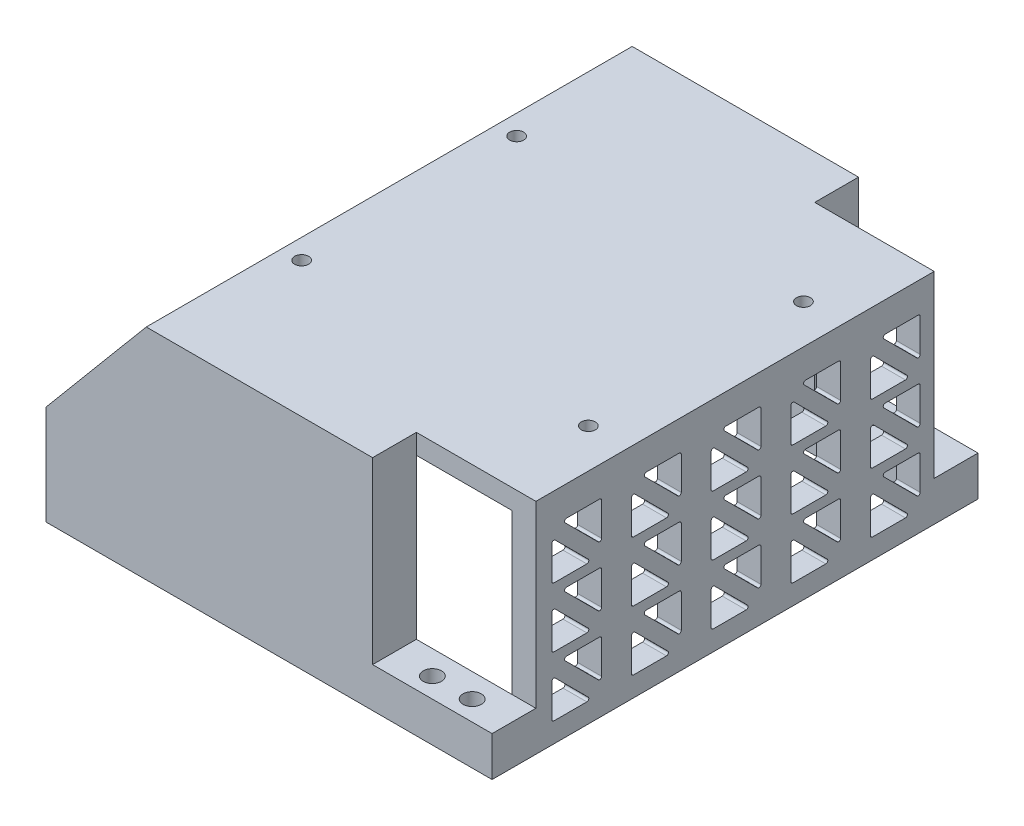
from build123d import *

# Parameters (mm, degrees)
BOSS_EXTRUDE1_DEPTH   = 50
SKETCH1_W             = 6
SKETCH1_H             = 100
BOSS_EXTRUDE1_2_DEPTH = 50
SKETCH1_3_R           = 2.3
BOSS_EXTRUDE2_DEPTH   = 10
CUT_EXTRUDE1_DEPTH    = 6
BOSS_EXTRUDE3_DEPTH   = 5
CHAMFER1_SIZE         = 30
CHAMFER1_SIZE2        = 25.172988935
CUT_EXTRUDE2_REACH    = 176.508
SKETCH4_R             = 1.75
CUT_EXTRUDE3_START    = -11
CUT_EXTRUDE3_DEPTH    = 100


with BuildPart() as part:
    # Sketch1 → Boss-Extrude1 (new body)
    with BuildSketch(Plane(origin=(0, 0, 0), x_dir=(1, 0, 0), z_dir=(0, 1, 0))):
        Polygon((0, 122), (0, 0), (82, 0), (82, 11), (26, 11), (26, 111), (82, 111), (82, 122), align=None)
    extrude(amount=BOSS_EXTRUDE1_DEPTH)



with BuildPart() as body_2:
    # Sketch1 → Boss-Extrude1 2 (new body)
    with BuildSketch(Plane(origin=(0, 0, 0), x_dir=(1, 0, 0), z_dir=(0, 1, 0))):
        with Locations((109, 61)):
            Rectangle(SKETCH1_W, SKETCH1_H)
    extrude(amount=BOSS_EXTRUDE1_2_DEPTH)


with BuildPart() as part_1:
    add(part.part)

    add(body_2.part)  # Boss-Extrude2 merges body 2
    # Sketch1<3> → Boss-Extrude2 (add)
    # profile 1 of 2: a face of its own
    with BuildSketch(Plane(origin=(0, 0, 0), x_dir=(1, 0, 0), z_dir=(0, 1, 0))):
        Polygon((112, 122), (82, 122), (82, 111), (106, 111), (112, 111), align=None)
        with Locations(Location((92, 117, 0), (0, 0, 270))):
            Circle(SKETCH1_3_R, mode=Mode.SUBTRACT)
        with Locations(Location((102, 117, 0), (0, 0, 270))):
            Circle(SKETCH1_3_R, mode=Mode.SUBTRACT)
    # profile 2 of 2: a face of its own
    with BuildSketch(Plane(origin=(0, 0, 0), x_dir=(1, 0, 0), z_dir=(0, 1, 0))):
        Polygon((82, 11), (82, 0), (112, 0), (112, 11), (106, 11), align=None)
        with Locations(Location((92, 5, 0), (0, 0, 270))):
            Circle(SKETCH1_3_R, mode=Mode.SUBTRACT)
        with Locations(Location((102, 5, 0), (0, 0, 270))):
            Circle(SKETCH1_3_R, mode=Mode.SUBTRACT)
    extrude(amount=BOSS_EXTRUDE2_DEPTH)

    # Sketch2 → Cut-Extrude1 (cut)
    with BuildSketch(Plane(origin=(112, 0, 0), x_dir=(0, 0, -1), z_dir=(1, 0, 0))):
        with BuildLine():
            Line((15, 35.5), (15, 43.792893219))
            ThreePointArc((15, 43.792893219), (15.308658284, 44.254832985), (15.853553391, 44.146446609))
            Line((15.853553391, 44.146446609), (24.146446609, 35.853553391))
            ThreePointArc((24.146446609, 35.853553391), (24.254832985, 35.308658284), (23.792893219, 35))
            Line((23.792893219, 35), (15.5, 35))
            ThreePointArc((15.5, 35), (15.146446609, 35.146446609), (15, 35.5))
        make_face()
        with BuildLine():
            Line((27.5, 38.707106781), (27.5, 47))
            ThreePointArc((27.5, 47), (27.353553391, 47.353553391), (27, 47.5))
            Line((27, 47.5), (18.707106781, 47.5))
            ThreePointArc((18.707106781, 47.5), (18.245167015, 47.191341716), (18.353553391, 46.646446609))
            Line((18.353553391, 46.646446609), (26.646446609, 38.353553391))
            ThreePointArc((26.646446609, 38.353553391), (27.191341716, 38.245167015), (27.5, 38.707106781))
        make_face()
        with BuildLine():
            Line((43.792893219, 35), (35.5, 35))
            ThreePointArc((35.5, 35), (35.146446609, 35.146446609), (35, 35.5))
            Line((35, 35.5), (35, 43.792893219))
            ThreePointArc((35, 43.792893219), (35.308658284, 44.254832985), (35.853553391, 44.146446609))
            Line((35.853553391, 44.146446609), (44.146446609, 35.853553391))
            ThreePointArc((44.146446609, 35.853553391), (44.254832985, 35.308658284), (43.792893219, 35))
        make_face()
        with BuildLine():
            Line((38.353553391, 46.646446609), (46.646446609, 38.353553391))
            ThreePointArc((46.646446609, 38.353553391), (47.191341716, 38.245167015), (47.5, 38.707106781))
            Line((47.5, 38.707106781), (47.5, 47))
            ThreePointArc((47.5, 47), (47.353553391, 47.353553391), (47, 47.5))
            Line((47, 47.5), (38.707106781, 47.5))
            ThreePointArc((38.707106781, 47.5), (38.245167015, 47.191341716), (38.353553391, 46.646446609))
        make_face()
        with BuildLine():
            Line((63.792893219, 35), (55.5, 35))
            ThreePointArc((55.5, 35), (55.146446609, 35.146446609), (55, 35.5))
            Line((55, 35.5), (55, 43.792893219))
            ThreePointArc((55, 43.792893219), (55.308658284, 44.254832985), (55.853553391, 44.146446609))
            Line((55.853553391, 44.146446609), (64.146446609, 35.853553391))
            ThreePointArc((64.146446609, 35.853553391), (64.254832985, 35.308658284), (63.792893219, 35))
        make_face()
        with BuildLine():
            Line((58.353553391, 46.646446609), (66.646446609, 38.353553391))
            ThreePointArc((66.646446609, 38.353553391), (67.191341716, 38.245167015), (67.5, 38.707106781))
            Line((67.5, 38.707106781), (67.5, 47))
            ThreePointArc((67.5, 47), (67.353553391, 47.353553391), (67, 47.5))
            Line((67, 47.5), (58.707106781, 47.5))
            ThreePointArc((58.707106781, 47.5), (58.245167015, 47.191341716), (58.353553391, 46.646446609))
        make_face()
        with BuildLine():
            Line((83.792893219, 35), (75.5, 35))
            ThreePointArc((75.5, 35), (75.146446609, 35.146446609), (75, 35.5))
            Line((75, 35.5), (75, 43.792893219))
            ThreePointArc((75, 43.792893219), (75.308658284, 44.254832985), (75.853553391, 44.146446609))
            Line((75.853553391, 44.146446609), (84.146446609, 35.853553391))
            ThreePointArc((84.146446609, 35.853553391), (84.254832985, 35.308658284), (83.792893219, 35))
        make_face()
        with BuildLine():
            Line((78.353553391, 46.646446609), (86.646446609, 38.353553391))
            ThreePointArc((86.646446609, 38.353553391), (87.191341716, 38.245167015), (87.5, 38.707106781))
            Line((87.5, 38.707106781), (87.5, 47))
            ThreePointArc((87.5, 47), (87.353553391, 47.353553391), (87, 47.5))
            Line((87, 47.5), (78.707106781, 47.5))
            ThreePointArc((78.707106781, 47.5), (78.245167015, 47.191341716), (78.353553391, 46.646446609))
        make_face()
        with BuildLine():
            Line((103.792893219, 35), (95.5, 35))
            ThreePointArc((95.5, 35), (95.146446609, 35.146446609), (95, 35.5))
            Line((95, 35.5), (95, 43.792893219))
            ThreePointArc((95, 43.792893219), (95.308658284, 44.254832985), (95.853553391, 44.146446609))
            Line((95.853553391, 44.146446609), (104.146446609, 35.853553391))
            ThreePointArc((104.146446609, 35.853553391), (104.254832985, 35.308658284), (103.792893219, 35))
        make_face()
        with BuildLine():
            Line((98.353553391, 46.646446609), (106.646446609, 38.353553391))
            ThreePointArc((106.646446609, 38.353553391), (107.191341716, 38.245167015), (107.5, 38.707106781))
            Line((107.5, 38.707106781), (107.5, 47))
            ThreePointArc((107.5, 47), (107.353553391, 47.353553391), (107, 47.5))
            Line((107, 47.5), (98.707106781, 47.5))
            ThreePointArc((98.707106781, 47.5), (98.245167015, 47.191341716), (98.353553391, 46.646446609))
        make_face()
        with BuildLine():
            Line((43.792893219, 20), (35.5, 20))
            ThreePointArc((35.5, 20), (35.146446609, 20.146446609), (35, 20.5))
            Line((35, 20.5), (35, 28.792893219))
            ThreePointArc((35, 28.792893219), (35.308658284, 29.254832985), (35.853553391, 29.146446609))
            Line((35.853553391, 29.146446609), (44.146446609, 20.853553391))
            ThreePointArc((44.146446609, 20.853553391), (44.254832985, 20.308658284), (43.792893219, 20))
        make_face()
        with BuildLine():
            Line((38.353553391, 31.646446609), (46.646446609, 23.353553391))
            ThreePointArc((46.646446609, 23.353553391), (47.191341716, 23.245167015), (47.5, 23.707106781))
            Line((47.5, 23.707106781), (47.5, 32))
            ThreePointArc((47.5, 32), (47.353553391, 32.353553391), (47, 32.5))
            Line((47, 32.5), (38.707106781, 32.5))
            ThreePointArc((38.707106781, 32.5), (38.245167015, 32.191341716), (38.353553391, 31.646446609))
        make_face()
        with BuildLine():
            Line((63.792893219, 20), (55.5, 20))
            ThreePointArc((55.5, 20), (55.146446609, 20.146446609), (55, 20.5))
            Line((55, 20.5), (55, 28.792893219))
            ThreePointArc((55, 28.792893219), (55.308658284, 29.254832985), (55.853553391, 29.146446609))
            Line((55.853553391, 29.146446609), (64.146446609, 20.853553391))
            ThreePointArc((64.146446609, 20.853553391), (64.254832985, 20.308658284), (63.792893219, 20))
        make_face()
        with BuildLine():
            Line((58.353553391, 31.646446609), (66.646446609, 23.353553391))
            ThreePointArc((66.646446609, 23.353553391), (67.191341716, 23.245167015), (67.5, 23.707106781))
            Line((67.5, 23.707106781), (67.5, 32))
            ThreePointArc((67.5, 32), (67.353553391, 32.353553391), (67, 32.5))
            Line((67, 32.5), (58.707106781, 32.5))
            ThreePointArc((58.707106781, 32.5), (58.245167015, 32.191341716), (58.353553391, 31.646446609))
        make_face()
        with BuildLine():
            Line((83.792893219, 20), (75.5, 20))
            ThreePointArc((75.5, 20), (75.146446609, 20.146446609), (75, 20.5))
            Line((75, 20.5), (75, 28.792893219))
            ThreePointArc((75, 28.792893219), (75.308658284, 29.254832985), (75.853553391, 29.146446609))
            Line((75.853553391, 29.146446609), (84.146446609, 20.853553391))
            ThreePointArc((84.146446609, 20.853553391), (84.254832985, 20.308658284), (83.792893219, 20))
        make_face()
        with BuildLine():
            Line((78.353553391, 31.646446609), (86.646446609, 23.353553391))
            ThreePointArc((86.646446609, 23.353553391), (87.191341716, 23.245167015), (87.5, 23.707106781))
            Line((87.5, 23.707106781), (87.5, 32))
            ThreePointArc((87.5, 32), (87.353553391, 32.353553391), (87, 32.5))
            Line((87, 32.5), (78.707106781, 32.5))
            ThreePointArc((78.707106781, 32.5), (78.245167015, 32.191341716), (78.353553391, 31.646446609))
        make_face()
        with BuildLine():
            Line((103.792893219, 20), (95.5, 20))
            ThreePointArc((95.5, 20), (95.146446609, 20.146446609), (95, 20.5))
            Line((95, 20.5), (95, 28.792893219))
            ThreePointArc((95, 28.792893219), (95.308658284, 29.254832985), (95.853553391, 29.146446609))
            Line((95.853553391, 29.146446609), (104.146446609, 20.853553391))
            ThreePointArc((104.146446609, 20.853553391), (104.254832985, 20.308658284), (103.792893219, 20))
        make_face()
        with BuildLine():
            Line((98.353553391, 31.646446609), (106.646446609, 23.353553391))
            ThreePointArc((106.646446609, 23.353553391), (107.191341716, 23.245167015), (107.5, 23.707106781))
            Line((107.5, 23.707106781), (107.5, 32))
            ThreePointArc((107.5, 32), (107.353553391, 32.353553391), (107, 32.5))
            Line((107, 32.5), (98.707106781, 32.5))
            ThreePointArc((98.707106781, 32.5), (98.245167015, 32.191341716), (98.353553391, 31.646446609))
        make_face()
        with BuildLine():
            Line((43.792893219, 5), (35.5, 5))
            ThreePointArc((35.5, 5), (35.146446609, 5.146446609), (35, 5.5))
            Line((35, 5.5), (35, 13.792893219))
            ThreePointArc((35, 13.792893219), (35.308658284, 14.254832985), (35.853553391, 14.146446609))
            Line((35.853553391, 14.146446609), (44.146446609, 5.853553391))
            ThreePointArc((44.146446609, 5.853553391), (44.254832985, 5.308658284), (43.792893219, 5))
        make_face()
        with BuildLine():
            Line((38.353553391, 16.646446609), (46.646446609, 8.353553391))
            ThreePointArc((46.646446609, 8.353553391), (47.191341716, 8.245167015), (47.5, 8.707106781))
            Line((47.5, 8.707106781), (47.5, 17))
            ThreePointArc((47.5, 17), (47.353553391, 17.353553391), (47, 17.5))
            Line((47, 17.5), (38.707106781, 17.5))
            ThreePointArc((38.707106781, 17.5), (38.245167015, 17.191341716), (38.353553391, 16.646446609))
        make_face()
        with BuildLine():
            Line((63.792893219, 5), (55.5, 5))
            ThreePointArc((55.5, 5), (55.146446609, 5.146446609), (55, 5.5))
            Line((55, 5.5), (55, 13.792893219))
            ThreePointArc((55, 13.792893219), (55.308658284, 14.254832985), (55.853553391, 14.146446609))
            Line((55.853553391, 14.146446609), (64.146446609, 5.853553391))
            ThreePointArc((64.146446609, 5.853553391), (64.254832985, 5.308658284), (63.792893219, 5))
        make_face()
        with BuildLine():
            Line((58.353553391, 16.646446609), (66.646446609, 8.353553391))
            ThreePointArc((66.646446609, 8.353553391), (67.191341716, 8.245167015), (67.5, 8.707106781))
            Line((67.5, 8.707106781), (67.5, 17))
            ThreePointArc((67.5, 17), (67.353553391, 17.353553391), (67, 17.5))
            Line((67, 17.5), (58.707106781, 17.5))
            ThreePointArc((58.707106781, 17.5), (58.245167015, 17.191341716), (58.353553391, 16.646446609))
        make_face()
        with BuildLine():
            Line((83.792893219, 5), (75.5, 5))
            ThreePointArc((75.5, 5), (75.146446609, 5.146446609), (75, 5.5))
            Line((75, 5.5), (75, 13.792893219))
            ThreePointArc((75, 13.792893219), (75.308658284, 14.254832985), (75.853553391, 14.146446609))
            Line((75.853553391, 14.146446609), (84.146446609, 5.853553391))
            ThreePointArc((84.146446609, 5.853553391), (84.254832985, 5.308658284), (83.792893219, 5))
        make_face()
        with BuildLine():
            Line((78.353553391, 16.646446609), (86.646446609, 8.353553391))
            ThreePointArc((86.646446609, 8.353553391), (87.191341716, 8.245167015), (87.5, 8.707106781))
            Line((87.5, 8.707106781), (87.5, 17))
            ThreePointArc((87.5, 17), (87.353553391, 17.353553391), (87, 17.5))
            Line((87, 17.5), (78.707106781, 17.5))
            ThreePointArc((78.707106781, 17.5), (78.245167015, 17.191341716), (78.353553391, 16.646446609))
        make_face()
        with BuildLine():
            Line((103.792893219, 5), (95.5, 5))
            ThreePointArc((95.5, 5), (95.146446609, 5.146446609), (95, 5.5))
            Line((95, 5.5), (95, 13.792893219))
            ThreePointArc((95, 13.792893219), (95.308658284, 14.254832985), (95.853553391, 14.146446609))
            Line((95.853553391, 14.146446609), (104.146446609, 5.853553391))
            ThreePointArc((104.146446609, 5.853553391), (104.254832985, 5.308658284), (103.792893219, 5))
        make_face()
        with BuildLine():
            Line((98.353553391, 16.646446609), (106.646446609, 8.353553391))
            ThreePointArc((106.646446609, 8.353553391), (107.191341716, 8.245167015), (107.5, 8.707106781))
            Line((107.5, 8.707106781), (107.5, 17))
            ThreePointArc((107.5, 17), (107.353553391, 17.353553391), (107, 17.5))
            Line((107, 17.5), (98.707106781, 17.5))
            ThreePointArc((98.707106781, 17.5), (98.245167015, 17.191341716), (98.353553391, 16.646446609))
        make_face()
        with BuildLine():
            Line((23.792893219, 20), (15.5, 20))
            ThreePointArc((15.5, 20), (15.146446609, 20.146446609), (15, 20.5))
            Line((15, 20.5), (15, 28.792893219))
            ThreePointArc((15, 28.792893219), (15.308658284, 29.254832985), (15.853553391, 29.146446609))
            Line((15.853553391, 29.146446609), (24.146446609, 20.853553391))
            ThreePointArc((24.146446609, 20.853553391), (24.254832985, 20.308658284), (23.792893219, 20))
        make_face()
        with BuildLine():
            Line((18.353553391, 31.646446609), (26.646446609, 23.353553391))
            ThreePointArc((26.646446609, 23.353553391), (27.191341716, 23.245167015), (27.5, 23.707106781))
            Line((27.5, 23.707106781), (27.5, 32))
            ThreePointArc((27.5, 32), (27.353553391, 32.353553391), (27, 32.5))
            Line((27, 32.5), (18.707106781, 32.5))
            ThreePointArc((18.707106781, 32.5), (18.245167015, 32.191341716), (18.353553391, 31.646446609))
        make_face()
        with BuildLine():
            Line((23.792893219, 5), (15.5, 5))
            ThreePointArc((15.5, 5), (15.146446609, 5.146446609), (15, 5.5))
            Line((15, 5.5), (15, 13.792893219))
            ThreePointArc((15, 13.792893219), (15.308658284, 14.254832985), (15.853553391, 14.146446609))
            Line((15.853553391, 14.146446609), (24.146446609, 5.853553391))
            ThreePointArc((24.146446609, 5.853553391), (24.254832985, 5.308658284), (23.792893219, 5))
        make_face()
        with BuildLine():
            Line((18.353553391, 16.646446609), (26.646446609, 8.353553391))
            ThreePointArc((26.646446609, 8.353553391), (27.191341716, 8.245167015), (27.5, 8.707106781))
            Line((27.5, 8.707106781), (27.5, 17))
            ThreePointArc((27.5, 17), (27.353553391, 17.353553391), (27, 17.5))
            Line((27, 17.5), (18.707106781, 17.5))
            ThreePointArc((18.707106781, 17.5), (18.245167015, 17.191341716), (18.353553391, 16.646446609))
        make_face()
    extrude(amount=-CUT_EXTRUDE1_DEPTH, mode=Mode.SUBTRACT)

    # Sketch3 → Boss-Extrude3 (add)
    with BuildSketch(Plane(origin=(0, 50, 0), x_dir=(1, 0, 0), z_dir=(0, 1, 0))):
        Polygon((112, 11), (82, 11), (82, 0), (0, 0), (0, 122), (82, 122), (82, 111), (112, 111), align=None)
    extrude(amount=BOSS_EXTRUDE3_DEPTH)

    # Chamfer1
    chamfer1_edges = [part_1.edges().sort_by_distance(p)[0] for p in [
        (0, 55, -61),
    ]]
    chamfer1_side = [part_1.faces().sort_by_distance(p)[0] for p in [
        (0, 27.5, -61),
    ]]
    chamfer(chamfer1_edges, length=CHAMFER1_SIZE, length2=CHAMFER1_SIZE2, reference=chamfer1_side[0])

    # Sketch4 → Cut-Extrude2 (cut, up to next)
    with BuildSketch(Plane(origin=(0, 55, 0), x_dir=(1, 0, 0), z_dir=(0, 1, 0)), mode=Mode.PRIVATE) as cut_extrude2_sk1:
        with Locations(Location((30.172988935, 88, 0), (0, 0, 270))):
            Circle(SKETCH4_R)
    cut_extrude2_tool1 = extrude(cut_extrude2_sk1.sketch, amount=-CUT_EXTRUDE2_REACH, mode=Mode.PRIVATE) & part_1.part
    # Sketch4 → Cut-Extrude2 (cut, up to next)
    with BuildSketch(Plane(origin=(0, 55, 0), x_dir=(1, 0, 0), z_dir=(0, 1, 0)), mode=Mode.PRIVATE) as cut_extrude2_sk2:
        with Locations(Location((102.172988935, 88, 0), (0, 0, 270))):
            Circle(SKETCH4_R)
    cut_extrude2_tool2 = extrude(cut_extrude2_sk2.sketch, amount=-CUT_EXTRUDE2_REACH, mode=Mode.PRIVATE) & part_1.part
    # Sketch4 → Cut-Extrude2 (cut, up to next)
    with BuildSketch(Plane(origin=(0, 55, 0), x_dir=(1, 0, 0), z_dir=(0, 1, 0)), mode=Mode.PRIVATE) as cut_extrude2_sk3:
        with Locations(Location((102.172988935, 34, 0), (0, 0, 270))):
            Circle(SKETCH4_R)
    cut_extrude2_tool3 = extrude(cut_extrude2_sk3.sketch, amount=-CUT_EXTRUDE2_REACH, mode=Mode.PRIVATE) & part_1.part
    # Sketch4 → Cut-Extrude2 (cut, up to next)
    with BuildSketch(Plane(origin=(0, 55, 0), x_dir=(1, 0, 0), z_dir=(0, 1, 0)), mode=Mode.PRIVATE) as cut_extrude2_sk4:
        with Locations(Location((30.172988935, 34, 0), (0, 0, 270))):
            Circle(SKETCH4_R)
    cut_extrude2_tool4 = extrude(cut_extrude2_sk4.sketch, amount=-CUT_EXTRUDE2_REACH, mode=Mode.PRIVATE) & part_1.part
    add(cut_extrude2_tool1.solids().sort_by_distance((30.172989, 55, -88))[0], mode=Mode.SUBTRACT)
    add(cut_extrude2_tool2.solids().sort_by_distance((102.172989, 55, -88))[0], mode=Mode.SUBTRACT)
    add(cut_extrude2_tool3.solids().sort_by_distance((102.172989, 55, -34))[0], mode=Mode.SUBTRACT)
    add(cut_extrude2_tool4.solids().sort_by_distance((30.172989, 55, -34))[0], mode=Mode.SUBTRACT)

    # Sketch5 → Cut-Extrude3 (cut)
    with BuildSketch(Plane.XY.offset(CUT_EXTRUDE3_START)):
        Polygon((25.172988935, 50), (3, 23.908089297), (3, 3), (25.172988935, 3), (26.417630528, 3), (26.417630528, 50), align=None)
    extrude(amount=-CUT_EXTRUDE3_DEPTH, mode=Mode.SUBTRACT)


solid = part_1.part
